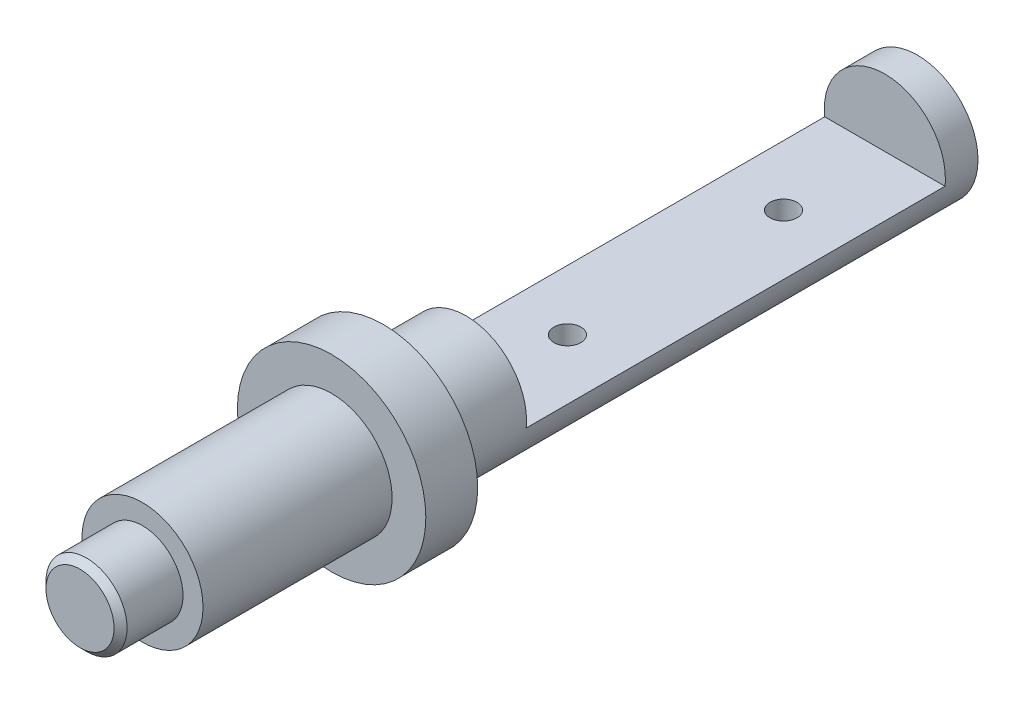
from build123d import *

# Parameters (mm, degrees)
CUT_EXTRUDE1_DEPTH      = 205.420962722
CUT_EXTRUDE1_DEPTH_BACK = 205.420962722
SKETCH2_W               = 193.8
SKETCH2_H               = 37.910107369
CUT_EXTRUDE2_DEPTH      = 205.420962722
CUT_EXTRUDE2_DEPTH_BACK = 205.420962722
SKETCH3_R               = 6.25
CHAMFER1_SIZE           = 3


with BuildPart() as part:
    # Sketch1 → Revolve1 (revolve)
    with BuildSketch(Plane(origin=(0, 0, 0), x_dir=(0, 0, -1), z_dir=(1, 0, 0)), mode=Mode.PRIVATE) as revolve1_sk:
        Polygon((192.6, 0), (192.6, 28), (-54.5, 28), (-54.5, 43.6), (-78.5, 43.6), (-78.5, 28), (-166, 28), (-166, 18.75), (-194.9, 18.75), (-194.9, 0), align=None)
    revolve(revolve1_sk.sketch.rotate(Axis((0, 0, 76.367145791), (0, 0, -1)), 90), axis=Axis((0, 0, 76.367145791), (0, 0, -1)))

    # Sketch2 → Cut-Extrude1 (cut, two sides: drawn at the far end of the back side and taken through both)
    with BuildSketch(Plane(origin=(0, 0, 0), x_dir=(0, 0, -1), z_dir=(1, 0, 0)).offset(-CUT_EXTRUDE1_DEPTH_BACK)):
        with Locations((80.6, 15.855053684)):
            Rectangle(SKETCH2_W, SKETCH2_H)
    extrude(amount=CUT_EXTRUDE1_DEPTH + CUT_EXTRUDE1_DEPTH_BACK, mode=Mode.SUBTRACT)

    # Sketch3 → Cut-Extrude2 (cut, two sides: drawn at the far end of the back side and taken through both)
    with BuildSketch(Plane(origin=(0, 0, 0), x_dir=(1, 0, 0), z_dir=(0, 1, 0)).offset(-CUT_EXTRUDE2_DEPTH_BACK)):
        with Locations(Location((0, 30.6, 0), (0, 0, 270))):
            Circle(SKETCH3_R)
        with Locations(Location((0, 130.6, 0), (0, 0, 270))):
            Circle(SKETCH3_R)
    extrude(amount=CUT_EXTRUDE2_DEPTH + CUT_EXTRUDE2_DEPTH_BACK, mode=Mode.SUBTRACT)

    # Chamfer1
    chamfer1_edges = [part.edges().sort_by_distance(p)[0] for p in [
        (-18.75, 0, 194.9),
    ]]
    chamfer(chamfer1_edges, length=CHAMFER1_SIZE)


solid = part.part
